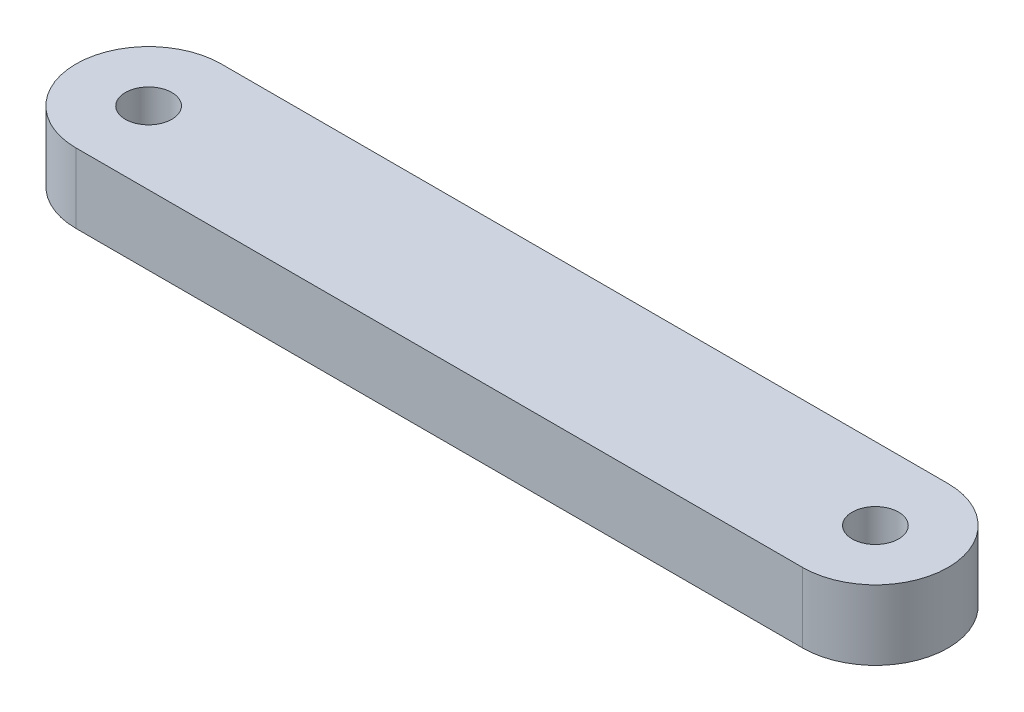
from build123d import *

# Parameters (mm, degrees)
SKETCH_1_R      = 1.6
EXTRUDE_1_DEPTH = 4.8


with BuildPart() as part:
    # ｽｹｯﾁ1 → ﾎﾞｽ - 押し出し1 (new body)
    with BuildSketch(Plane(origin=(0, 0, 0), x_dir=(1, 0, 0), z_dir=(0, 1, 0))):
        with BuildLine():
            Line((-25, 5), (25, 5))
            ThreePointArc((25, 5), (30, 0), (25, -5))
            Line((25, -5), (-25, -5))
            ThreePointArc((-25, -5), (-30, 0), (-25, 5))
        make_face()
        with Locations(Location((-25, 0, 0), (0, 0, 270))):
            Circle(SKETCH_1_R, mode=Mode.SUBTRACT)
        with Locations(Location((25, 0, 0), (0, 0, 270))):
            Circle(SKETCH_1_R, mode=Mode.SUBTRACT)
    extrude(amount=EXTRUDE_1_DEPTH)


solid = part.part
